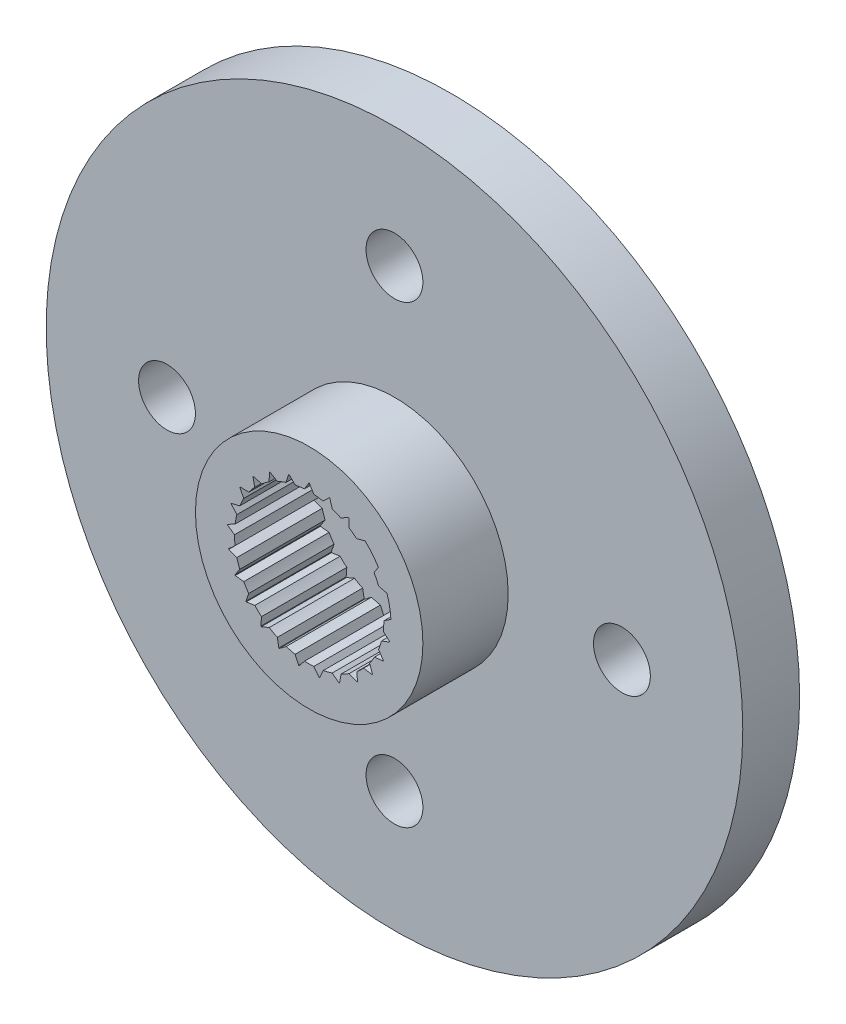
from build123d import *

# Parameters (mm, degrees)
SKETCH1_R           = 12.25
BOSS_EXTRUDE1_DEPTH = 2
SKETCH2_R           = 1
CUT_EXTRUDE1_DEPTH  = 2
SKETCH3_R           = 1.35
CUT_EXTRUDE2_DEPTH  = 4
SKETCH4_R           = 4
SKETCH4_R_2         = 2.88
BOSS_EXTRUDE2_DEPTH = 3
SKETCH6_R           = 2
CUT_EXTRUDE3_DEPTH  = 1
BOSS_EXTRUDE4_START = -3
BOSS_EXTRUDE4_DEPTH = 3


with BuildPart() as part:
    # Sketch1 → Boss-Extrude1 (new body)
    with BuildSketch(Plane.XY):
        Circle(SKETCH1_R)
    extrude(amount=BOSS_EXTRUDE1_DEPTH)

    # Sketch2 → Cut-Extrude1 (cut)
    with BuildSketch(Plane.XY.offset(2)):
        with Locations((-8, 0)):
            Circle(SKETCH2_R)
        with Locations((0, 8)):
            Circle(SKETCH2_R)
        with Locations((8, 0)):
            Circle(SKETCH2_R)
        with Locations((0, -8)):
            Circle(SKETCH2_R)
    extrude(amount=-CUT_EXTRUDE1_DEPTH, mode=Mode.SUBTRACT)

    # Sketch3 → Cut-Extrude2 (cut)
    with BuildSketch(Plane.XY.offset(2)):
        Circle(SKETCH3_R)
    extrude(amount=-CUT_EXTRUDE2_DEPTH, mode=Mode.SUBTRACT)

    # Sketch4 → Boss-Extrude2 (add)
    with BuildSketch(Plane.XY.offset(2)):
        Circle(SKETCH4_R)
        Circle(SKETCH4_R_2, mode=Mode.SUBTRACT)
    extrude(amount=BOSS_EXTRUDE2_DEPTH)

    # Sketch6 → Cut-Extrude3 (cut)
    with BuildSketch(Plane(origin=(0, 0, 0), x_dir=(-1, 0, 0), z_dir=(0, 0, -1))):
        Circle(SKETCH6_R)
    extrude(amount=-CUT_EXTRUDE3_DEPTH, mode=Mode.SUBTRACT)

    # Sketch5 → Boss-Extrude4 (add)
    with BuildSketch(Plane.XY.offset(5).offset(BOSS_EXTRUDE4_START)):
        with BuildLine():
            Line((-0.161756527, -2.620613729), (-0.351910166, -2.85841901))
            ThreePointArc((-0.351910166, -2.85841901), (0.000368858, -2.879999976), (0.352642342, -2.858328774))
            Line((0.352642342, -2.858328774), (0.162522941, -2.62056631))
            ThreePointArc((0.162522941, -2.62056631), (0.00038394, -2.625601139), (-0.161756527, -2.620613729))
        make_face()
        with BuildLine():
            ThreePointArc((-1.051714162, -2.681100021), (-0.715869599, -2.789611212), (-0.369274025, -2.856227703))
            Line((-0.369274025, -2.856227703), (-0.494291356, -2.578654212))
            ThreePointArc((-0.494291356, -2.578654212), (-0.652588574, -2.543208533), (-0.808394781, -2.498055117))
            Line((-0.808394781, -2.498055117), (-1.051714162, -2.681100021))
        make_face()
        with BuildLine():
            Line((0.495045485, -2.578509542), (0.37000564, -2.85613302))
            ThreePointArc((0.37000564, -2.85613302), (0.716584139, -2.78942775), (1.052400895, -2.680830535))
            Line((1.052400895, -2.680830535), (0.809125323, -2.497818589))
            ThreePointArc((0.809125323, -2.497818589), (0.653332329, -2.54301757), (0.495045485, -2.578509542))
        make_face()
        with BuildLine():
            ThreePointArc((-1.685435089, -2.335317657), (-1.387127337, -2.523940917), (-1.067987548, -2.674659342))
            Line((-1.067987548, -2.674659342), (-1.12004751, -2.374715787))
            ThreePointArc((-1.12004751, -2.374715787), (-1.264556547, -2.301016782), (-1.404238617, -2.218534516))
            Line((-1.404238617, -2.218534516), (-1.685435089, -2.335317657))
        make_face()
        with BuildLine():
            Line((1.120741967, -2.374388118), (1.068672631, -2.674385688))
            ThreePointArc((1.068672631, -2.674385688), (1.387773803, -2.523585519), (1.686033229, -2.334885854))
            Line((1.686033229, -2.334885854), (1.404887387, -2.218123739))
            ThreePointArc((1.404887387, -2.218123739), (1.265229445, -2.300646853), (1.120741967, -2.374388118))
        make_face()
        with BuildLine():
            ThreePointArc((-2.213253931, -1.842798696), (-1.971226763, -2.09968213), (-1.699595485, -2.325032298))
            Line((-1.699595485, -2.325032298), (-1.675426958, -2.021565235))
            ThreePointArc((-1.675426958, -2.021565235), (-1.797067781, -1.914243684), (-1.911848977, -1.799615231))
            Line((-1.911848977, -1.799615231), (-2.213253931, -1.842798696))
        make_face()
        with BuildLine():
            Line((1.676018111, -2.021075155), (1.70019099, -2.324596868))
            ThreePointArc((1.70019099, -2.324596868), (1.971764535, -2.099177129), (2.213725894, -1.842231708))
            Line((2.213725894, -1.842231708), (1.912375208, -1.799056017))
            ThreePointArc((1.912375208, -1.799056017), (1.797627541, -1.913718034), (1.676018111, -2.021075155))
        make_face()
        with BuildLine():
            ThreePointArc((-2.602005889, -1.234489916), (-2.431466761, -1.543492594), (-2.224411588, -1.829314923))
            Line((-2.224411588, -1.829314923), (-2.12553317, -1.541392304))
            ThreePointArc((-2.12553317, -1.541392304), (-2.216662638, -1.407191614), (-2.299330835, -1.267619503))
            Line((-2.299330835, -1.267619503), (-2.602005889, -1.234489916))
        make_face()
        with BuildLine():
            Line((2.125983872, -1.540770608), (2.224880096, -1.828745077))
            ThreePointArc((2.224880096, -1.828745077), (2.43186205, -1.54286972), (2.60232202, -1.233823368))
            Line((2.60232202, -1.233823368), (2.299701462, -1.26694699))
            ThreePointArc((2.299701462, -1.26694699), (2.217074088, -1.406543272), (2.125983872, -1.540770608))
        make_face()
        with BuildLine():
            ThreePointArc((-2.827264247, -0.548613595), (-2.738928761, -0.890319741), (-2.609459729, -1.218654964))
            Line((-2.609459729, -1.218654964), (-2.442084315, -0.964368026))
            ThreePointArc((-2.442084315, -0.964368026), (-2.496976429, -0.811720521), (-2.542337279, -0.655974579))
            Line((-2.542337279, -0.655974579), (-2.827264247, -0.548613595))
        make_face()
        with BuildLine():
            Line((2.442366248, -0.963653777), (2.609771804, -1.217986508))
            ThreePointArc((2.609771804, -1.217986508), (2.739156728, -0.889618132), (2.827404683, -0.547889369))
            Line((2.827404683, -0.547889369), (2.542529016, -0.655231023))
            ThreePointArc((2.542529016, -0.655231023), (2.497213717, -0.810990224), (2.442366248, -0.963653777))
        make_face()
        with BuildLine():
            ThreePointArc((-2.874875195, 0.171734137), (-2.874293794, -0.181204825), (-2.830545919, -0.531422432))
            Line((-2.830545919, -0.531422432), (-2.605190321, -0.326748959))
            ThreePointArc((-2.605190321, -0.326748959), (-2.620396008, -0.165246042), (-2.625599323, -0.00311236))
            Line((-2.625599323, -0.00311236), (-2.874875195, 0.171734137))
        make_face()
        with BuildLine():
            Line((2.60528577, -0.325987035), (2.830681951, -0.530697366))
            ThreePointArc((2.830681951, -0.530697366), (2.874340115, -0.180468565), (2.874831111, 0.172470535))
            Line((2.874831111, 0.172470535), (2.625600121, -0.002344481))
            ThreePointArc((2.625600121, -0.002344481), (2.620444223, -0.164479678), (2.60528577, -0.325987035))
        make_face()
        with BuildLine():
            ThreePointArc((-2.741847161, 0.881291181), (-2.829056376, 0.539295857), (-2.873778498, 0.189201326))
            Line((-2.873778498, 0.189201326), (-2.604602638, 0.331400948))
            ThreePointArc((-2.604602638, 0.331400948), (-2.579166468, 0.491611454), (-2.543885305, 0.64994542))
            Line((-2.543885305, 0.64994542), (-2.741847161, 0.881291181))
        make_face()
        with BuildLine():
            ThreePointArc((-2.436538786, 1.535473459), (-2.606058942, 1.225910597), (-2.736441006, 0.897936869))
            Line((-2.736441006, 0.897936869), (-2.440358193, 0.968727714))
            ThreePointArc((-2.440358193, 0.968727714), (-2.375878414, 1.117579194), (-2.302329617, 1.262164738))
            Line((-2.302329617, 1.262164738), (-2.436538786, 1.535473459))
        make_face()
        with BuildLine():
            ThreePointArc((-1.978133718, 2.093176293), (-2.21931324, 1.835496865), (-2.427162861, 1.550251736))
            Line((-2.427162861, 1.550251736), (-2.122777067, 1.545185755))
            ThreePointArc((-2.122777067, 1.545185755), (-2.023305181, 1.673325323), (-1.916110092, 1.795077605))
            Line((-1.916110092, 1.795077605), (-1.978133718, 2.093176293))
        make_face()
        with BuildLine():
            Line((2.440995413, 0.967120926), (2.73696806, 0.89632909))
            ThreePointArc((2.73696806, 0.89632909), (2.605878342, 1.226294446), (2.435183429, 1.537622082))
            Line((2.435183429, 1.537622082), (2.282024688, 1.298516389))
            ThreePointArc((2.282024688, 1.298516389), (2.367316087, 1.135603819), (2.440995413, 0.967120926))
        make_face()
        with BuildLine():
            ThreePointArc((-1.395435234, 2.519357162), (-1.693119925, 2.329752115), (-1.965377147, 2.105158585))
            Line((-1.965377147, 2.105158585), (-1.671814051, 2.024554092))
            ThreePointArc((-1.671814051, 2.024554092), (-1.543600242, 2.123930268), (-1.409494323, 2.215199143))
            Line((-1.409494323, 2.215199143), (-1.395435234, 2.519357162))
        make_face()
        with BuildLine():
            ThreePointArc((-0.725056422, 2.787237554), (-1.060541659, 2.677620472), (-1.380099559, 2.527790578))
            Line((-1.380099559, 2.527790578), (-1.115804809, 2.37671225))
            ThreePointArc((-1.115804809, 2.37671225), (-0.966905223, 2.441080863), (-0.814314842, 2.496131573))
            Line((-0.814314842, 2.496131573), (-0.725056422, 2.787237554))
        make_face()
        with BuildLine():
            ThreePointArc((-0.009119648, 2.879985561), (-0.361325659, 2.857244086), (-0.70810524, 2.791592192))
            Line((-0.70810524, 2.791592192), (-0.489685448, 2.579532836))
            ThreePointArc((-0.489685448, 2.579532836), (-0.329455993, 2.60484937), (-0.167968964, 2.620222876))
            Line((-0.167968964, 2.620222876), (-0.009119648, 2.879985561))
        make_face()
        with BuildLine():
            Line((1.671221881, 2.025042942), (1.964837844, 2.10566195))
            ThreePointArc((1.964837844, 2.10566195), (1.6925231, 2.330185734), (1.394789851, 2.519714522))
            Line((1.394789851, 2.519714522), (1.408846409, 2.215611267))
            ThreePointArc((1.408846409, 2.215611267), (1.542979014, 2.124381616), (1.671221881, 2.025042942))
        make_face()
        with BuildLine():
            ThreePointArc((0.707390147, 2.791773483), (0.36059376, 2.857336547), (0.008381935, 2.879987803))
            Line((0.008381935, 2.879987803), (0.167202651, 2.620271888))
            ThreePointArc((0.167202651, 2.620271888), (0.328694169, 2.604945611), (0.488931021, 2.579675939))
            Line((0.488931021, 2.579675939), (0.707390147, 2.791773483))
        make_face()
        with BuildLine():
            Line((1.115109672, 2.377038475), (1.379452017, 2.52814401))
            ThreePointArc((1.379452017, 2.52814401), (1.059855747, 2.677892043), (0.724342443, 2.787423187))
            Line((0.724342443, 2.787423187), (0.813584792, 2.49636962))
            ThreePointArc((0.813584792, 2.49636962), (0.966191267, 2.441363538), (1.115109672, 2.377038475))
        make_face()
    extrude(amount=BOSS_EXTRUDE4_DEPTH)


solid = part.part
